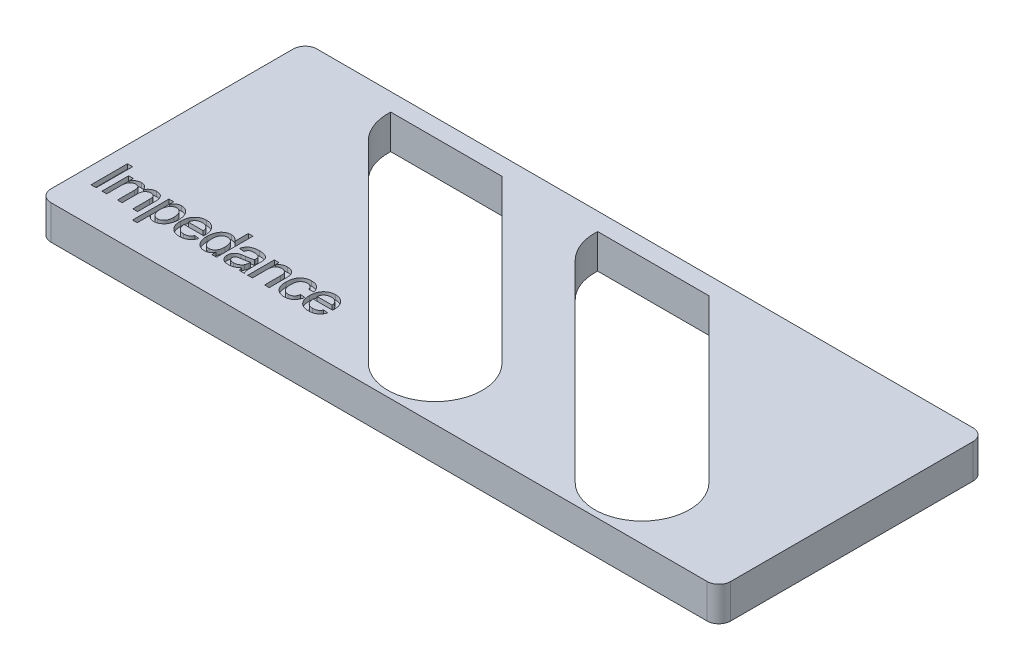
from build123d import *

# Parameters (mm, degrees)
BOSS_EXTRUDE1_DEPTH = 2.9
CUT_EXTRUDE3_DEPTH  = 10
SKETCH3_W           = 0.434638546
SKETCH3_H           = 3.081982422
CUT_EXTRUDE4_DEPTH  = 0.5


with BuildPart() as part:
    # Sketch1 → Boss-Extrude1 (new body)
    with BuildSketch(Plane(origin=(0, 0, 0), x_dir=(1, 0, 0), z_dir=(0, 1, 0))):
        with BuildLine():
            Line((1, 0), (56.5, 0))
            ThreePointArc((56.5, 0), (57.207106781, 0.292893219), (57.5, 1))
            Line((57.5, 1), (57.5, 21.5))
            ThreePointArc((57.5, 21.5), (57.207106781, 22.207106781), (56.5, 22.5))
            Line((56.5, 22.5), (1, 22.5))
            ThreePointArc((1, 22.5), (0.292893219, 22.207106781), (0, 21.5))
            Line((0, 21.5), (0, 1))
            ThreePointArc((0, 1), (0.292893219, 0.292893219), (1, 0))
        make_face()
    extrude(amount=BOSS_EXTRUDE1_DEPTH)

    # Sketch2 → Cut-Extrude3 (cut)
    with BuildSketch(Plane(origin=(0, 3, 0), x_dir=(1, 0, 0), z_dir=(0, 1, 0))):
        with BuildLine():
            Line((18.156854249, 21), (31.828427125, 7.328427125))
            ThreePointArc((31.828427125, 7.328427125), (31.828427125, 1.671572875), (26.171572875, 1.671572875))
            Line((26.171572875, 1.671572875), (9.908116908, 17.935028843))
            ThreePointArc((9.908116908, 17.935028843), (8.997362549, 19.342709039), (8.743544293, 21))
            Line((8.743544293, 21), (18.156854249, 21))
        make_face()
        with BuildLine():
            Line((35.656854249, 21), (49.328427125, 7.328427125))
            ThreePointArc((49.328427125, 7.328427125), (49.328427125, 1.671572875), (43.671572875, 1.671572875))
            Line((43.671572875, 1.671572875), (27.408116908, 17.935028843))
            ThreePointArc((27.408116908, 17.935028843), (26.497362549, 19.342709039), (26.243544293, 21))
            Line((26.243544293, 21), (35.656854249, 21))
        make_face()
    extrude(amount=-CUT_EXTRUDE3_DEPTH, mode=Mode.SUBTRACT)

    # Sketch3 → Cut-Extrude4 (cut)
    # profile 1 of 9: a face of its own
    with BuildSketch(Plane(origin=(0, 3, 0), x_dir=(1, 0, 0), z_dir=(0, 1, 0))):
        with Locations((1.612445225, 4.540991211)):
            Rectangle(SKETCH3_W, SKETCH3_H)
    # profile 2 of 9: a face of its own
    with BuildSketch(Plane(origin=(0, 3, 0), x_dir=(1, 0, 0), z_dir=(0, 1, 0))):
        with BuildLine():
            Line((2.324659752, 3), (2.324659752, 5.252217924))
            Line((2.324659752, 5.252217924), (2.719785704, 5.252217924))
            Line((2.719785704, 5.252217924), (2.719785704, 4.900926257))
            add(Edge.make_bspline(
                [(2.719785704, 4.900926257), (2.737179718, 4.929415421), (2.77149805, 4.985624446), (2.83514727, 5.060724793), (2.905728649, 5.127882251), (2.984106566, 5.186243828), (3.070150727, 5.233461139), (3.162634962, 5.267657893), (3.261182454, 5.287886444), (3.328637921, 5.290430692), (3.363100144, 5.291730519)],
                knots=[0, 0, 0, 0, 1.012837134, 1.998324314, 2.98019487, 3.968118755, 4.958650973, 5.951725623, 6.953560186, 8, 8, 8, 8], degree=3))
            add(Edge.make_bspline(
                [(3.363100144, 5.291730519), (3.400662819, 5.290596042), (3.472931705, 5.288413359), (3.575869892, 5.267088327), (3.668373143, 5.232350937), (3.750196849, 5.183894088), (3.820434427, 5.122309409), (3.880856139, 5.050568338), (3.928865005, 4.966708363), (3.950755853, 4.905233515), (3.961962914, 4.873761348)],
                knots=[0, 0, 0, 0, 1.14260047, 2.198311542, 3.184080093, 4.139503782, 5.07683556, 6.015590709, 6.984077836, 8, 8, 8, 8], degree=3))
            add(Edge.make_bspline(
                [(3.961962914, 4.873761348), (3.983822982, 4.907063215), (4.02620043, 4.971621485), (4.10080341, 5.056249037), (4.178334602, 5.129621037), (4.261974573, 5.18885319), (4.35055266, 5.235283716), (4.444320628, 5.26810289), (4.543141666, 5.287687991), (4.610539934, 5.290368404), (4.644789949, 5.291730519)],
                knots=[0, 0, 0, 0, 1.138522562, 2.207114883, 3.219638414, 4.186902816, 5.129823568, 6.072192529, 7.02033929, 8, 8, 8, 8], degree=3))
            add(Edge.make_bspline(
                [(4.644789949, 5.291730519), (4.671363286, 5.291126513), (4.723213947, 5.289947959), (4.798572282, 5.281130372), (4.869397918, 5.26733664), (4.935275973, 5.246668644), (4.996609175, 5.220858134), (5.053406012, 5.189321196), (5.104812669, 5.151313783), (5.151676055, 5.10781536), (5.193160462, 5.057920547), (5.229900955, 5.002251111), (5.260095788, 4.939830028), (5.284540506, 4.871422001), (5.304625978, 4.797187022), (5.317506204, 4.716267344), (5.326669292, 4.629487867), (5.327295109, 4.56941751), (5.327616984, 4.538521674)],
                knots=[0, 0, 0, 0, 1.095882962, 2.138318376, 3.1255456, 4.06796008, 4.980856081, 5.866385201, 6.740777206, 7.611659656, 8.497473544, 9.411000816, 10.356316449, 11.349910013, 12.40416823, 13.523408539, 14.726220937, 16, 16, 16, 16], degree=3))
            Line((5.327616984, 4.538521674), (5.327616984, 3))
            Line((5.327616984, 3), (4.932491033, 3))
            Line((4.932491033, 3), (4.932491033, 4.392818979))
            add(Edge.make_bspline(
                [(4.932491033, 4.392818979), (4.93192064, 4.427598661), (4.930863198, 4.492076156), (4.925802075, 4.581138367), (4.914000833, 4.65438789), (4.899128125, 4.714317471), (4.876943479, 4.763851844), (4.848520649, 4.80698279), (4.811658993, 4.844482358), (4.768746202, 4.876816475), (4.720454179, 4.903609467), (4.667390527, 4.922912678), (4.609863797, 4.934116672), (4.570136329, 4.93543792), (4.549712767, 4.936117162)],
                knots=[0, 0, 0, 0, 1.637099343, 3.034992218, 4.192454477, 5.125064895, 5.931363659, 6.734457378, 7.542615046, 8.392902438, 9.255454751, 10.131653416, 11.039498489, 12, 12, 12, 12], degree=3))
            add(Edge.make_bspline(
                [(4.549712767, 4.936117162), (4.531160543, 4.935682503), (4.494726542, 4.934828891), (4.44148282, 4.926935229), (4.390360579, 4.915714136), (4.342168354, 4.897975732), (4.295982057, 4.876270665), (4.252074708, 4.849891023), (4.211072786, 4.817740822), (4.172154906, 4.781621733), (4.136422333, 4.740054631), (4.106065017, 4.691950487), (4.081157148, 4.637970489), (4.059827196, 4.578529817), (4.043501707, 4.513382977), (4.0317807, 4.44236185), (4.025165203, 4.365574353), (4.024201194, 4.312365953), (4.023701344, 4.284776727)],
                knots=[0, 0, 0, 0, 0.936978583, 1.840096209, 2.715540616, 3.577474171, 4.428863993, 5.292176944, 6.159677271, 7.057388756, 7.97228745, 8.921538631, 9.921836886, 10.971267826, 12.108934396, 13.31095831, 14.605698001, 16, 16, 16, 16], degree=3))
            Line((4.023701344, 4.284776727), (4.023701344, 3))
            Line((4.023701344, 3), (3.628575393, 3))
            Line((3.628575393, 3), (3.628575393, 4.436653264))
            add(Edge.make_bspline(
                [(3.628575393, 4.436653264), (3.628426185, 4.456832357), (3.628138046, 4.495800621), (3.623437961, 4.552434835), (3.617149382, 4.605310884), (3.60709693, 4.654138002), (3.59499618, 4.699083085), (3.579385702, 4.739872688), (3.561651809, 4.777322825), (3.54051266, 4.810885096), (3.516507144, 4.840790158), (3.488817006, 4.866500535), (3.45779314, 4.888377789), (3.422675947, 4.905606183), (3.384302966, 4.919111809), (3.34250147, 4.928922655), (3.297237416, 4.935325968), (3.265782416, 4.935847315), (3.249501433, 4.936117162)],
                knots=[0, 0, 0, 0, 1.345752242, 2.598810075, 3.789149697, 4.895786345, 5.921724826, 6.890687139, 7.805619527, 8.681717145, 9.530827886, 10.356528998, 11.194466742, 12.054057324, 12.95727461, 13.903003647, 14.914602983, 16, 16, 16, 16], degree=3))
            add(Edge.make_bspline(
                [(3.249501433, 4.936117162), (3.224298946, 4.935305984), (3.174390332, 4.933699604), (3.101503722, 4.916619503), (3.031421652, 4.890543853), (2.965068822, 4.854302933), (2.904036515, 4.8082879), (2.85211713, 4.750897306), (2.809423144, 4.683974624), (2.781206694, 4.621321683), (2.763332003, 4.565707294), (2.751811361, 4.518846494), (2.742008745, 4.467727868), (2.734155094, 4.412070527), (2.727089108, 4.35220772), (2.723356244, 4.287687357), (2.719725563, 4.218962233), (2.719765204, 4.171595562), (2.719785704, 4.147100028)],
                knots=[0, 0, 0, 0, 1.117976261, 2.213934112, 3.307715435, 4.433034498, 5.561469973, 6.68771744, 7.851930709, 9.075635627, 9.729167061, 10.44550689, 11.218440431, 12.040901402, 12.942650761, 13.89578902, 14.911813504, 16, 16, 16, 16], degree=3))
            Line((2.719785704, 4.147100028), (2.719785704, 3))
            Line((2.719785704, 3), (2.324659752, 3))
        make_face()
    # profile 3 of 9: a face of its own
    with BuildSketch(Plane(origin=(0, 3, 0), x_dir=(1, 0, 0), z_dir=(0, 1, 0))):
        with BuildLine():
            Line((5.733608899, 2.170235502), (5.733608899, 5.252217924))
            Line((5.733608899, 5.252217924), (6.128734851, 5.252217924))
            Line((6.128734851, 5.252217924), (6.128734851, 4.894752414))
            add(Edge.make_bspline(
                [(6.128734851, 4.894752414), (6.148552427, 4.926202314), (6.186728156, 4.986786053), (6.251028053, 5.06854064), (6.320027109, 5.136950963), (6.393018088, 5.194078596), (6.472883218, 5.237865963), (6.559721246, 5.269801796), (6.654779099, 5.28844715), (6.720722877, 5.290612686), (6.75476253, 5.291730519)],
                knots=[0, 0, 0, 0, 1.141868254, 2.199646056, 3.187916027, 4.121412168, 5.038483649, 5.974824485, 6.95462054, 8, 8, 8, 8], degree=3))
            add(Edge.make_bspline(
                [(6.75476253, 5.291730519), (6.777417803, 5.291226045), (6.82221199, 5.290228596), (6.888418961, 5.283196924), (6.952872507, 5.272296409), (7.015271575, 5.256280516), (7.075282255, 5.235184158), (7.133111823, 5.209475875), (7.189389386, 5.180179287), (7.243112128, 5.145383655), (7.293989137, 5.106458153), (7.342753247, 5.064668605), (7.3870157, 5.017705745), (7.429198804, 4.968012655), (7.467555709, 4.914075096), (7.502143543, 4.856035762), (7.534239256, 4.794750235), (7.572031292, 4.707382296), (7.612166526, 4.592778814), (7.644785025, 4.448152679), (7.666055566, 4.297549653), (7.668489528, 4.194918408), (7.669726062, 4.142778338)],
                knots=[0, 0, 0, 0, 0.824202902, 1.629620634, 2.419929953, 3.200854495, 3.970497378, 4.731532444, 5.501903467, 6.276628953, 7.056871135, 7.831705169, 8.610184821, 9.402088757, 10.202023236, 11.014889876, 11.858855485, 12.71721399, 14.476656902, 16.267557585, 18.103795699, 20, 20, 20, 20], degree=3))
            add(Edge.make_bspline(
                [(7.669726062, 4.142778338), (7.668418706, 4.087131845), (7.665860138, 3.978228584), (7.642403256, 3.81907736), (7.604260626, 3.668401855), (7.559800404, 3.549533694), (7.517181696, 3.46012001), (7.48104846, 3.397658567), (7.442302835, 3.338938398), (7.400119251, 3.283953664), (7.353627711, 3.233598763), (7.304347259, 3.186521748), (7.251635289, 3.143571669), (7.177259015, 3.093348685), (7.080424156, 3.040750337), (6.959404145, 2.99413827), (6.834868645, 2.96600942), (6.750579423, 2.962327381), (6.708458708, 2.960487405)],
                knots=[0, 0, 0, 0, 1.566750505, 3.066217315, 4.520030908, 5.938083948, 6.632957415, 7.30813415, 7.968947793, 8.613647255, 9.257851326, 9.897527079, 10.532192309, 11.170526994, 12.423402314, 13.627070148, 14.814207778, 16, 16, 16, 16], degree=3))
            add(Edge.make_bspline(
                [(6.708458708, 2.960487405), (6.67790313, 2.961418962), (6.618127613, 2.963241355), (6.531021218, 2.981645446), (6.448335452, 3.009432599), (6.371837138, 3.050473245), (6.301101023, 3.099094709), (6.236745081, 3.154336762), (6.178403983, 3.215090484), (6.145336151, 3.26014363), (6.128734851, 3.282762009)],
                knots=[0, 0, 0, 0, 1.060500719, 2.074645059, 3.081194601, 4.082546779, 5.08044464, 6.05947861, 7.025785017, 8, 8, 8, 8], degree=3))
            Line((6.128734851, 3.282762009), (6.128734851, 2.170235502))
            Line((6.128734851, 2.170235502), (5.733608899, 2.170235502))
        make_face()
        with BuildLine():
            add(Edge.make_bspline(
                [(6.128734851, 4.107587433), (6.129115832, 4.074847165), (6.12985269, 4.011524015), (6.138119895, 3.919977903), (6.150851861, 3.835175456), (6.168533144, 3.756793747), (6.191944517, 3.68508702), (6.220271422, 3.619834216), (6.253752474, 3.561036074), (6.292616209, 3.509208105), (6.335687804, 3.464353475), (6.380009865, 3.424253302), (6.427153357, 3.390892212), (6.476302187, 3.36330981), (6.527926416, 3.342108186), (6.581903091, 3.327599217), (6.637722569, 3.317778204), (6.675695078, 3.316663723), (6.694876253, 3.316100761)],
                knots=[0, 0, 0, 0, 1.437434546, 2.78015081, 4.032764778, 5.2012756, 6.304456418, 7.34047555, 8.320212436, 9.269161424, 10.176980179, 11.047598006, 11.89018243, 12.707424221, 13.518042872, 14.333683991, 15.158288469, 16, 16, 16, 16], degree=3))
            add(Edge.make_bspline(
                [(6.694876253, 3.316100761), (6.714457865, 3.316701244), (6.753226565, 3.317890112), (6.810338954, 3.327151863), (6.864797363, 3.343612049), (6.917503266, 3.365117112), (6.967335539, 3.394117488), (7.016107885, 3.427895688), (7.061636995, 3.469360056), (7.105758349, 3.516035463), (7.146025186, 3.569791171), (7.180670143, 3.630828981), (7.209491421, 3.698704199), (7.233675978, 3.773026534), (7.251878637, 3.85451762), (7.265332806, 3.942579441), (7.273454045, 4.037670454), (7.274209007, 4.103249233), (7.27460011, 4.137221879)],
                knots=[0, 0, 0, 0, 0.83316913, 1.649551805, 2.453198062, 3.250183293, 4.066002037, 4.901882611, 5.770302609, 6.681184977, 7.632314019, 8.620852534, 9.660448002, 10.765528849, 11.942537832, 13.209677882, 14.554492318, 16, 16, 16, 16], degree=3))
            add(Edge.make_bspline(
                [(7.27460011, 4.137221879), (7.274211396, 4.169549991), (7.273457424, 4.232255377), (7.265243929, 4.322987011), (7.252335872, 4.407548474), (7.234879481, 4.485968916), (7.211400181, 4.558172257), (7.182289994, 4.623879555), (7.148357168, 4.68362521), (7.10927879, 4.736777226), (7.066853162, 4.783531754), (7.021863318, 4.824127288), (6.975303681, 4.858789174), (6.926291952, 4.88687104), (6.875610848, 4.909610946), (6.822322947, 4.924638989), (6.767267201, 4.934460305), (6.729904695, 4.935559089), (6.710928245, 4.936117162)],
                knots=[0, 0, 0, 0, 1.417753527, 2.749952742, 3.99222208, 5.168205227, 6.27013346, 7.316877701, 8.315654914, 9.278031164, 10.204687429, 11.080340169, 11.932552405, 12.745464952, 13.553904146, 14.362393741, 15.168258362, 16, 16, 16, 16], degree=3))
            add(Edge.make_bspline(
                [(6.710928245, 4.936117162), (6.691950453, 4.935583801), (6.654346883, 4.93452697), (6.59896284, 4.924228559), (6.545416383, 4.907565474), (6.493870515, 4.883578837), (6.443501774, 4.853758316), (6.394630656, 4.817372988), (6.348247113, 4.773358219), (6.303280517, 4.72385184), (6.26193391, 4.66782599), (6.225895407, 4.605524915), (6.195657582, 4.537178369), (6.171046066, 4.46271728), (6.152032234, 4.382334316), (6.138836854, 4.296023985), (6.129682158, 4.20388974), (6.129056961, 4.140332887), (6.128734851, 4.107587433)],
                knots=[0, 0, 0, 0, 0.806892931, 1.598819005, 2.388223016, 3.187667544, 4.012236564, 4.875742748, 5.774202643, 6.729148108, 7.718801443, 8.731210163, 9.785807378, 10.893572366, 12.063989118, 13.296455458, 14.607092894, 16, 16, 16, 16], degree=3))
        make_face(mode=Mode.SUBTRACT)
    # profile 4 of 9: a face of its own
    with BuildSketch(Plane(origin=(0, 3, 0), x_dir=(1, 0, 0), z_dir=(0, 1, 0))):
        with BuildLine():
            Line((9.498788787, 3.671714118), (9.885888742, 3.632201522))
            add(Edge.make_bspline(
                [(9.885888742, 3.632201522), (9.877951659, 3.606090642), (9.862337864, 3.554725432), (9.830657391, 3.481874031), (9.795844829, 3.412661744), (9.754714496, 3.348596783), (9.709584527, 3.288315652), (9.659560737, 3.232299177), (9.60354967, 3.181960741), (9.543633271, 3.135198161), (9.478814603, 3.094101733), (9.409776942, 3.057818486), (9.336267497, 3.027873974), (9.258496066, 3.002928521), (9.176284878, 2.98390274), (9.089786457, 2.970758862), (8.999114926, 2.961446926), (8.937199931, 2.960812437), (8.905482475, 2.960487405)],
                knots=[0, 0, 0, 0, 1.017198368, 2.001028156, 2.958938375, 3.904526299, 4.836491671, 5.766019286, 6.700699831, 7.641977538, 8.598163567, 9.559604839, 10.547559217, 11.555094156, 12.60347703, 13.691418688, 14.817373327, 16, 16, 16, 16], degree=3))
            add(Edge.make_bspline(
                [(8.905482475, 2.960487405), (8.865718172, 2.961421848), (8.788190112, 2.963243722), (8.674969823, 2.977859264), (8.568023938, 3.000979425), (8.467119551, 3.033736631), (8.372903298, 3.07642527), (8.285135924, 3.128927717), (8.203271507, 3.190030988), (8.12848848, 3.26081116), (8.060827785, 3.339696733), (8.003042787, 3.427410578), (7.952926845, 3.521850575), (7.913067799, 3.624550794), (7.881562964, 3.734482966), (7.859703595, 3.852114934), (7.845717974, 3.976979996), (7.844305961, 4.062890673), (7.84358148, 4.106970049)],
                knots=[0, 0, 0, 0, 1.077616366, 2.10101772, 3.089143248, 4.040031729, 4.971276009, 5.886882173, 6.807369977, 7.734796568, 8.672701003, 9.618074947, 10.576315496, 11.565652878, 12.598619221, 13.67195277, 14.805516698, 16, 16, 16, 16], degree=3))
            add(Edge.make_bspline(
                [(7.84358148, 4.106970049), (7.844312982, 4.152691371), (7.845733336, 4.241468241), (7.859539643, 4.370727195), (7.882372422, 4.492088753), (7.913355845, 4.605993223), (7.95441093, 4.711890359), (8.004505576, 4.809741555), (8.063330037, 4.900076606), (8.131452534, 4.981572715), (8.206830538, 5.054042637), (8.287069109, 5.118484376), (8.37385223, 5.171666004), (8.465405999, 5.215821057), (8.562612816, 5.249745405), (8.664873875, 5.274729018), (8.772967817, 5.288826586), (8.846791278, 5.290748855), (8.884491409, 5.291730519)],
                knots=[0, 0, 0, 0, 1.232307979, 2.392766439, 3.499416159, 4.558769794, 5.570548426, 6.555643267, 7.517416609, 8.470735273, 9.412423306, 10.33263532, 11.239503873, 12.150233765, 13.067967044, 14.009932887, 14.983713455, 16, 16, 16, 16], degree=3))
            add(Edge.make_bspline(
                [(8.884491409, 5.291730519), (8.920967718, 5.290792525), (8.992352919, 5.288956843), (9.096934651, 5.274223481), (9.196588395, 5.251200118), (9.291104931, 5.217759941), (9.380008563, 5.173864138), (9.464259456, 5.121473485), (9.543269061, 5.059071706), (9.616530655, 4.987509072), (9.683282872, 4.907589065), (9.741024541, 4.819001741), (9.789917371, 4.722992773), (9.829552326, 4.618828162), (9.860061859, 4.507108294), (9.882165205, 4.387760027), (9.89610462, 4.260823938), (9.897512623, 4.173479313), (9.898236428, 4.128578499)],
                knots=[0, 0, 0, 0, 1.005323219, 1.967446859, 2.906060863, 3.821317632, 4.724696067, 5.63467896, 6.55185077, 7.494776645, 8.453732942, 9.416859909, 10.403972786, 11.418730779, 12.484189468, 13.592581733, 14.76243057, 16, 16, 16, 16], degree=3))
            add(Edge.make_bspline(
                [(9.898236428, 4.128578499), (9.898048403, 4.114584139), (9.897594901, 4.080830885), (9.896831288, 4.047083142), (9.896384275, 4.027327474)],
                knots=[0, 0, 0, 0, 0.829215456, 2, 2, 2, 2], degree=3))
            Line((9.896384275, 4.027327474), (8.238707432, 4.027327474))
            add(Edge.make_bspline(
                [(8.238707432, 4.027327474), (8.240994909, 3.999500421), (8.24547013, 3.945059582), (8.258520527, 3.86623929), (8.276132353, 3.792164377), (8.299839948, 3.723487077), (8.327846511, 3.659438227), (8.362457909, 3.601071332), (8.401017949, 3.547090054), (8.445322475, 3.498810489), (8.493135652, 3.455866212), (8.544301487, 3.418194407), (8.598729242, 3.386948624), (8.655631531, 3.360680977), (8.715540095, 3.340914539), (8.778181532, 3.326769091), (8.843905447, 3.317919259), (8.888785068, 3.316714647), (8.911656318, 3.316100761)],
                knots=[0, 0, 0, 0, 1.224729154, 2.396059788, 3.502114335, 4.561587772, 5.580251543, 6.563724943, 7.533714888, 8.486186356, 9.43260269, 10.350144711, 11.268619442, 12.181885516, 13.095687177, 14.031096784, 14.996620783, 16, 16, 16, 16], degree=3))
            add(Edge.make_bspline(
                [(8.911656318, 3.316100761), (8.945049967, 3.317218835), (9.009741902, 3.319384827), (9.103086503, 3.334580815), (9.188651504, 3.361374392), (9.267038215, 3.398567386), (9.338116561, 3.447869717), (9.400138384, 3.510975791), (9.455280381, 3.585767814), (9.483960502, 3.642422393), (9.498788787, 3.671714118)],
                knots=[0, 0, 0, 0, 1.096312125, 2.123833578, 3.094060441, 4.030938787, 4.962563683, 5.918139224, 6.923629937, 8, 8, 8, 8], degree=3))
        make_face()
        with BuildLine():
            Line((8.238707432, 4.38294083), (9.503110477, 4.38294083))
            add(Edge.make_bspline(
                [(9.503110477, 4.38294083), (9.500623261, 4.402517966), (9.49576021, 4.440795549), (9.48552427, 4.496159291), (9.471872782, 4.547741261), (9.455431656, 4.595347717), (9.435382819, 4.639069797), (9.412730898, 4.678974588), (9.387420222, 4.715488247), (9.367748731, 4.736708469), (9.358025166, 4.747197567)],
                knots=[0, 0, 0, 0, 1.185316253, 2.317552585, 3.379013743, 4.387694847, 5.339152611, 6.263729899, 7.141766409, 8, 8, 8, 8], degree=3))
            add(Edge.make_bspline(
                [(9.358025166, 4.747197567), (9.342489127, 4.762361236), (9.311802793, 4.792312074), (9.260640369, 4.83092062), (9.205655873, 4.862938224), (9.14791827, 4.890563529), (9.086136126, 4.910577339), (9.021546406, 4.925696611), (8.953250008, 4.934261417), (8.906534292, 4.935489169), (8.882639256, 4.936117162)],
                knots=[0, 0, 0, 0, 0.989486767, 1.954405495, 2.91383024, 3.888017634, 4.867526279, 5.869356945, 6.910178459, 8, 8, 8, 8], degree=3))
            add(Edge.make_bspline(
                [(8.882639256, 4.936117162), (8.861012523, 4.935614944), (8.818679685, 4.934631885), (8.756314097, 4.927714111), (8.696540656, 4.916246217), (8.63946532, 4.899231156), (8.584879609, 4.878551366), (8.533167333, 4.852116211), (8.483966515, 4.82139948), (8.437473121, 4.786263716), (8.39541372, 4.746887619), (8.35694985, 4.704943316), (8.325105619, 4.658585242), (8.2968709, 4.609973379), (8.274762924, 4.557590616), (8.257358551, 4.502208618), (8.244969354, 4.443674754), (8.240813338, 4.403365857), (8.238707432, 4.38294083)],
                knots=[0, 0, 0, 0, 1.10270868, 2.158476208, 3.195774995, 4.201977093, 5.192014471, 6.168217026, 7.158254405, 8.146844603, 9.134487423, 10.093158795, 11.042305272, 11.996428104, 12.955501471, 13.934632866, 14.95345241, 16, 16, 16, 16], degree=3))
        make_face(mode=Mode.SUBTRACT)
    # profile 5 of 9: a face of its own
    with BuildSketch(Plane(origin=(0, 3, 0), x_dir=(1, 0, 0), z_dir=(0, 1, 0))):
        with BuildLine():
            Line((11.613083058, 3), (11.613083058, 3.340178749))
            add(Edge.make_bspline(
                [(11.613083058, 3.340178749), (11.595736093, 3.310037708), (11.561998616, 3.251417499), (11.500056459, 3.174168806), (11.433378594, 3.107523784), (11.359353759, 3.053971322), (11.279986286, 3.011420475), (11.194004289, 2.981444929), (11.10196366, 2.964185534), (11.038576628, 2.961737847), (11.006194292, 2.960487405)],
                knots=[0, 0, 0, 0, 1.103362039, 2.145888452, 3.135274512, 4.089918948, 5.037552437, 5.986650811, 6.971446531, 8, 8, 8, 8], degree=3))
            add(Edge.make_bspline(
                [(11.006194292, 2.960487405), (10.984771139, 2.9609896), (10.942230603, 2.961986822), (10.879136971, 2.969138136), (10.817000326, 2.979717552), (10.756674998, 2.99713047), (10.69708285, 3.016895017), (10.639468046, 3.042950914), (10.582510633, 3.072076146), (10.527937413, 3.107141934), (10.474559341, 3.144712439), (10.425497399, 3.188052758), (10.378137019, 3.23329021), (10.33497407, 3.28334387), (10.294057825, 3.336318559), (10.256394138, 3.393317701), (10.221805713, 3.453974461), (10.179502461, 3.540126703), (10.136465539, 3.655742137), (10.098413378, 3.803156814), (10.076157666, 3.960588945), (10.073468818, 4.06882742), (10.072091847, 4.124256809)],
                knots=[0, 0, 0, 0, 0.77053297, 1.530068252, 2.282316003, 3.034891571, 3.786446796, 4.538913108, 5.307166389, 6.0856609, 6.870571251, 7.652718378, 8.438047608, 9.225050126, 10.027638366, 10.844878463, 11.68052307, 12.538083257, 14.29538088, 16.10719674, 18.006478707, 20, 20, 20, 20], degree=3))
            add(Edge.make_bspline(
                [(10.072091847, 4.124256809), (10.073258967, 4.178663088), (10.075544897, 4.285223707), (10.097515185, 4.440985113), (10.130996713, 4.589403521), (10.170937102, 4.707144096), (10.210695133, 4.795684077), (10.243287709, 4.858065831), (10.279072512, 4.91647456), (10.31884976, 4.970482659), (10.362219029, 5.020407425), (10.408410685, 5.067137314), (10.458812157, 5.108945246), (10.511790122, 5.147513086), (10.567869347, 5.180975272), (10.625207042, 5.210900373), (10.684494227, 5.235813119), (10.74545003, 5.255950013), (10.807871502, 5.272286952), (10.871920511, 5.283190775), (10.937507833, 5.290230671), (10.981892233, 5.291226714), (11.004342139, 5.291730519)],
                knots=[0, 0, 0, 0, 1.942572473, 3.804739629, 5.607757427, 7.372400532, 8.234575402, 9.073137612, 9.885175988, 10.679209825, 11.466269922, 12.246051373, 13.023576858, 13.803011661, 14.584731492, 15.35415098, 16.111962335, 16.87916584, 17.645911282, 18.414627976, 19.198108944, 20, 20, 20, 20], degree=3))
            add(Edge.make_bspline(
                [(11.004342139, 5.291730519), (11.036740659, 5.290556928), (11.100198311, 5.288258263), (11.192689915, 5.26977551), (11.279900896, 5.239832716), (11.360194587, 5.196120531), (11.434815164, 5.144840697), (11.501637264, 5.084655965), (11.56281259, 5.018632429), (11.596225686, 4.968711552), (11.613083058, 4.943525774)],
                knots=[0, 0, 0, 0, 1.060352338, 2.076868624, 3.076621313, 4.068618914, 5.061440509, 6.03539041, 7.008827079, 8, 8, 8, 8], degree=3))
            Line((11.613083058, 4.943525774), (11.613083058, 6.081982422))
            Line((11.613083058, 6.081982422), (12.008209009, 6.081982422))
            Line((12.008209009, 6.081982422), (12.008209009, 3))
            Line((12.008209009, 3), (11.613083058, 3))
        make_face()
        with BuildLine():
            add(Edge.make_bspline(
                [(10.467217798, 4.124874193), (10.467612314, 4.092134667), (10.468377819, 4.028607894), (10.476542079, 3.936411288), (10.48974435, 3.850491481), (10.509080039, 3.771087001), (10.532741699, 3.697902911), (10.562534285, 3.631236158), (10.597858986, 3.571071219), (10.637881504, 3.517263667), (10.682197139, 3.470315042), (10.728126888, 3.429041695), (10.775994288, 3.393674492), (10.826547797, 3.366069465), (10.87851205, 3.343510409), (10.932729358, 3.327201945), (10.988995344, 3.317911975), (11.027152439, 3.316706464), (11.046324271, 3.316100761)],
                knots=[0, 0, 0, 0, 1.410877411, 2.737623334, 3.985990085, 5.15425658, 6.25668075, 7.296968516, 8.294984083, 9.258336811, 10.180925624, 11.073031181, 11.91760706, 12.739566167, 13.550247201, 14.355718555, 15.173839401, 16, 16, 16, 16], degree=3))
            add(Edge.make_bspline(
                [(11.046324271, 3.316100761), (11.065696079, 3.316741651), (11.103811924, 3.31800266), (11.160087657, 3.32659016), (11.213798683, 3.342305018), (11.265341744, 3.363377347), (11.314869414, 3.390138197), (11.3615598, 3.423725563), (11.406372513, 3.463051814), (11.44897166, 3.507960185), (11.48809199, 3.559128127), (11.52154893, 3.617353638), (11.549750527, 3.68182268), (11.573314547, 3.752446432), (11.590900783, 3.829416574), (11.603673744, 3.912356655), (11.611972988, 4.00164114), (11.612704517, 4.063322063), (11.613083058, 4.095239747)],
                knots=[0, 0, 0, 0, 0.85918428, 1.690525522, 2.516740253, 3.335408561, 4.156363302, 5.007314812, 5.880540866, 6.797374501, 7.748460685, 8.730022766, 9.767976038, 10.864778839, 12.027110887, 13.265104655, 14.584788925, 16, 16, 16, 16], degree=3))
            add(Edge.make_bspline(
                [(11.613083058, 4.095239747), (11.612699489, 4.130242875), (11.611956072, 4.198084377), (11.603708611, 4.295994436), (11.591104182, 4.386830391), (11.572666855, 4.470484799), (11.548892652, 4.547015453), (11.519610491, 4.616220029), (11.485984297, 4.678589425), (11.446056006, 4.733003933), (11.4025952, 4.780560441), (11.357038644, 4.822396321), (11.308213101, 4.857045968), (11.257669943, 4.886503995), (11.204295357, 4.908844577), (11.148430195, 4.92410938), (11.090347028, 4.934617653), (11.050487791, 4.935612569), (11.030272279, 4.936117162)],
                knots=[0, 0, 0, 0, 1.460870622, 2.831394293, 4.098585508, 5.286659173, 6.403387286, 7.438947734, 8.419411421, 9.354210979, 10.24820955, 11.105802691, 11.930715615, 12.742688104, 13.543632756, 14.337822166, 15.156989001, 16, 16, 16, 16], degree=3))
            add(Edge.make_bspline(
                [(11.030272279, 4.936117162), (11.010688892, 4.935524382), (10.971916677, 4.934350765), (10.915082792, 4.925018475), (10.860837345, 4.909114191), (10.808561641, 4.888621385), (10.759736259, 4.860112765), (10.712706998, 4.826542171), (10.66864651, 4.786335886), (10.62678162, 4.740423788), (10.589004417, 4.687761685), (10.556287079, 4.627994892), (10.528498502, 4.561345672), (10.505575666, 4.487590991), (10.489052171, 4.406629316), (10.475678377, 4.319110969), (10.46857844, 4.224390815), (10.467682205, 4.158840682), (10.467217798, 4.124874193)],
                knots=[0, 0, 0, 0, 0.845773811, 1.674507211, 2.479288598, 3.284953443, 4.093262871, 4.914908037, 5.777293998, 6.664794475, 7.594954488, 8.56988236, 9.601878838, 10.709817382, 11.900789722, 13.168188159, 14.532623814, 16, 16, 16, 16], degree=3))
        make_face(mode=Mode.SUBTRACT)
    # profile 6 of 9: a face of its own
    with BuildSketch(Plane(origin=(0, 3, 0), x_dir=(1, 0, 0), z_dir=(0, 1, 0))):
        with BuildLine():
            add(Edge.make_bspline(
                [(13.841593424, 3.276588166), (13.806964498, 3.249352572), (13.740247719, 3.196879934), (13.638327649, 3.128961831), (13.539825964, 3.073030793), (13.442776579, 3.030265121), (13.345374441, 2.999097582), (13.246007611, 2.976867065), (13.143122169, 2.96271699), (13.073202042, 2.961237412), (13.037759067, 2.960487405)],
                knots=[0, 0, 0, 0, 1.197047628, 2.306255791, 3.325459075, 4.272204958, 5.183179809, 6.100503351, 7.037132558, 8, 8, 8, 8], degree=3))
            add(Edge.make_bspline(
                [(13.037759067, 2.960487405), (13.008931605, 2.961159506), (12.953014652, 2.962463187), (12.871615113, 2.970250355), (12.795403744, 2.9844426), (12.724252217, 3.004364504), (12.657659435, 3.028554747), (12.5968097, 3.059904397), (12.540872156, 3.096208068), (12.490839844, 3.138441117), (12.446491343, 3.184864554), (12.407221773, 3.234238907), (12.374431826, 3.287222323), (12.346992508, 3.342933459), (12.325834919, 3.402162275), (12.311229067, 3.464509713), (12.302439438, 3.529877407), (12.301222479, 3.57434579), (12.300602214, 3.597010617)],
                knots=[0, 0, 0, 0, 1.258692688, 2.441500428, 3.565802525, 4.638326649, 5.664695568, 6.653201623, 7.620115754, 8.570354797, 9.504485475, 10.41940588, 11.319425392, 12.219534596, 13.126122865, 14.058869773, 15.010636805, 16, 16, 16, 16], degree=3))
            add(Edge.make_bspline(
                [(12.300602214, 3.597010617), (12.301338756, 3.623828692), (12.302787787, 3.676588987), (12.317046879, 3.753648632), (12.339016575, 3.827250142), (12.370846271, 3.896222919), (12.409465818, 3.960172198), (12.454362724, 4.018030421), (12.504234752, 4.069767475), (12.560687301, 4.11368727), (12.621258456, 4.151608986), (12.68531232, 4.185368403), (12.753130294, 4.213762471), (12.800349401, 4.228551078), (12.824144099, 4.236003367)],
                knots=[0, 0, 0, 0, 1.081160721, 2.127011708, 3.15154375, 4.173548368, 5.183333295, 6.160067524, 7.123185218, 8.075175306, 9.03822139, 10.004020623, 10.994184154, 12, 12, 12, 12], degree=3))
            add(Edge.make_bspline(
                [(12.824144099, 4.236003367), (12.844260928, 4.241173614), (12.888934932, 4.252655327), (12.963530522, 4.265892453), (13.051530104, 4.280513155), (13.114896546, 4.288511933), (13.148888241, 4.292802723)],
                knots=[0, 0, 0, 0, 0.755247122, 1.677198421, 2.753978269, 4, 4, 4, 4], degree=3))
            add(Edge.make_bspline(
                [(13.148888241, 4.292802723), (13.184496662, 4.297489365), (13.253288024, 4.306543416), (13.353010318, 4.320438851), (13.44540734, 4.335875622), (13.530541734, 4.352112486), (13.60855793, 4.367658861), (13.678897199, 4.385113626), (13.742208655, 4.402760755), (13.781552978, 4.416114676), (13.800228676, 4.422453425)],
                knots=[0, 0, 0, 0, 1.295688514, 2.50312072, 3.632112522, 4.674678079, 5.629835945, 6.501350263, 7.28863104, 8, 8, 8, 8], degree=3))
            add(Edge.make_bspline(
                [(13.800228676, 4.422453425), (13.800437546, 4.433360485), (13.800815891, 4.453117486), (13.801280028, 4.47946275), (13.802187197, 4.499209932), (13.802111008, 4.510121506), (13.802080829, 4.514443686)],
                knots=[0, 0, 0, 0, 1.422721786, 2.577112132, 3.436380362, 4, 4, 4, 4], degree=3))
            add(Edge.make_bspline(
                [(13.802080829, 4.514443686), (13.801633024, 4.531736094), (13.800773301, 4.5649351), (13.796815155, 4.612893452), (13.788683689, 4.656867678), (13.777726383, 4.697002523), (13.763820168, 4.733379936), (13.74539864, 4.76485003), (13.725270917, 4.793575645), (13.708532623, 4.809196995), (13.70021242, 4.816961993)],
                knots=[0, 0, 0, 0, 1.26154989, 2.42199954, 3.505345601, 4.517638791, 5.454101631, 6.334651141, 7.172195178, 8, 8, 8, 8], degree=3))
            add(Edge.make_bspline(
                [(13.70021242, 4.816961993), (13.688312156, 4.826573604), (13.663978897, 4.846227103), (13.62209129, 4.869575315), (13.577187069, 4.890992511), (13.527595485, 4.90759203), (13.47405643, 4.920341125), (13.416269105, 4.929539059), (13.354382582, 4.935139368), (13.311684189, 4.935784352), (13.289651861, 4.936117162)],
                knots=[0, 0, 0, 0, 0.839762797, 1.717118621, 2.62848608, 3.573318781, 4.586191294, 5.652292021, 6.78858503, 8, 8, 8, 8], degree=3))
            add(Edge.make_bspline(
                [(13.289651861, 4.936117162), (13.269065702, 4.935906944), (13.229503838, 4.935502953), (13.17202546, 4.931667304), (13.118822864, 4.925761326), (13.069532071, 4.917103162), (13.024794586, 4.906092681), (12.983767248, 4.893128379), (12.947020276, 4.877415984), (12.90333899, 4.852176961), (12.854185253, 4.811728626), (12.806061122, 4.747676796), (12.763820363, 4.670370352), (12.745125706, 4.61158632), (12.73524076, 4.580503806)],
                knots=[0, 0, 0, 0, 1.022193202, 1.964420342, 2.859404845, 3.679355848, 4.447752811, 5.145854219, 5.814144269, 6.427678132, 7.647232431, 8.943346363, 10.383770637, 12, 12, 12, 12], degree=3))
            Line((12.73524076, 4.580503806), (12.340114809, 4.620016401))
            add(Edge.make_bspline(
                [(12.340114809, 4.620016401), (12.349181039, 4.657092456), (12.366687377, 4.728684053), (12.405207244, 4.828533625), (12.451829155, 4.917208352), (12.5064506, 4.9963666), (12.573590091, 5.064643859), (12.652340805, 5.12474569), (12.744757894, 5.174852668), (12.848903927, 5.217366962), (12.963961877, 5.250884675), (13.088602004, 5.274707974), (13.221820589, 5.288936932), (13.313488295, 5.290781496), (13.360651055, 5.291730519)],
                knots=[0, 0, 0, 0, 1.021253436, 1.971977998, 2.856928585, 3.699335328, 4.537187707, 5.410097588, 6.342486875, 7.343316183, 8.417452201, 9.545747471, 10.737294414, 12, 12, 12, 12], degree=3))
            add(Edge.make_bspline(
                [(13.360651055, 5.291730519), (13.406777837, 5.290924286), (13.494684083, 5.289387805), (13.619644362, 5.277335954), (13.731218247, 5.256863105), (13.829149972, 5.227205998), (13.914279834, 5.191130488), (13.987779602, 5.151430672), (14.049305209, 5.106793783), (14.099453028, 5.056934207), (14.139683333, 5.00115365), (14.17220548, 4.939438486), (14.199369042, 4.871416259), (14.211373999, 4.822903682), (14.217580463, 4.797823079)],
                knots=[0, 0, 0, 0, 1.532418085, 2.920410157, 4.166262907, 5.295392887, 6.3126657, 7.233843889, 8.065362582, 8.82930282, 9.573337446, 10.341184706, 11.142406151, 12, 12, 12, 12], degree=3))
            add(Edge.make_bspline(
                [(14.217580463, 4.797823079), (14.220771741, 4.778720307), (14.228114033, 4.734769855), (14.232219114, 4.659149693), (14.236321975, 4.56573585), (14.236579192, 4.497372119), (14.236719376, 4.460113868)],
                knots=[0, 0, 0, 0, 0.685842966, 1.577944182, 2.67997895, 4, 4, 4, 4], degree=3))
            Line((14.236719376, 4.460113868), (14.236719376, 3.97793673))
            add(Edge.make_bspline(
                [(14.236719376, 3.97793673), (14.236946555, 3.937601052), (14.237380051, 3.860633893), (14.237666029, 3.750527024), (14.239363216, 3.651316556), (14.242802648, 3.562638826), (14.245643388, 3.484623721), (14.249077218, 3.417075869), (14.253976099, 3.36046421), (14.26122409, 3.299331789), (14.273861861, 3.230783676), (14.295272749, 3.152134424), (14.321291972, 3.074636112), (14.343911954, 3.024930294), (14.355257161, 3)],
                knots=[0, 0, 0, 0, 1.460752392, 2.787357723, 3.987454144, 5.053844556, 6.001073417, 6.814649835, 7.502887566, 8.058452826, 9.043678907, 10.023506295, 11.008675999, 12, 12, 12, 12], degree=3))
            Line((14.355257161, 3), (13.96013121, 3))
            add(Edge.make_bspline(
                [(13.96013121, 3), (13.945505658, 3.020194902), (13.916276574, 3.060554303), (13.883556144, 3.128476189), (13.85661572, 3.200207753), (13.846650619, 3.250875012), (13.841593424, 3.276588166)],
                knots=[0, 0, 0, 0, 0.98283144, 1.964183219, 2.966842269, 4, 4, 4, 4], degree=3))
        make_face()
        with BuildLine():
            add(Edge.make_bspline(
                [(13.802080829, 4.066840069), (13.784659876, 4.060642869), (13.747894972, 4.047564394), (13.68859632, 4.03181801), (13.623805909, 4.014524921), (13.55234497, 3.999664364), (13.475093309, 3.983926621), (13.391229175, 3.969964802), (13.301488414, 3.956406642), (13.239452254, 3.948201477), (13.207539749, 3.943980594)],
                knots=[0, 0, 0, 0, 0.729352295, 1.539213581, 2.419656264, 3.375381672, 4.41857158, 5.530700671, 6.729748458, 8, 8, 8, 8], degree=3))
            add(Edge.make_bspline(
                [(13.207539749, 3.943980594), (13.172714716, 3.939342029), (13.108437468, 3.930780539), (13.020702555, 3.914786262), (12.949287766, 3.89848462), (12.892223571, 3.881261562), (12.845858166, 3.860954861), (12.807451806, 3.835730779), (12.773414381, 3.807439987), (12.745762911, 3.774343143), (12.723177354, 3.738787037), (12.707959815, 3.700368333), (12.697234473, 3.660565913), (12.696233317, 3.633096599), (12.695728165, 3.619236452)],
                knots=[0, 0, 0, 0, 1.886220442, 3.481434204, 4.78676141, 5.817751327, 6.678319802, 7.493641666, 8.277504993, 9.045791761, 9.800124555, 10.528599956, 11.257578043, 12, 12, 12, 12], degree=3))
            add(Edge.make_bspline(
                [(12.695728165, 3.619236452), (12.696892147, 3.598248494), (12.699179834, 3.55699884), (12.721707615, 3.498700231), (12.756766039, 3.445971351), (12.805522102, 3.399338899), (12.868305345, 3.361663193), (12.943951249, 3.334599725), (13.031980262, 3.318997039), (13.094698201, 3.317103227), (13.127897175, 3.316100761)],
                knots=[0, 0, 0, 0, 0.849267971, 1.669148087, 2.501462232, 3.405991702, 4.385156294, 5.453560725, 6.652073551, 8, 8, 8, 8], degree=3))
            add(Edge.make_bspline(
                [(13.127897175, 3.316100761), (13.161945511, 3.316995674), (13.228687908, 3.318749904), (13.325660523, 3.337631879), (13.417282383, 3.36615848), (13.501490013, 3.407326011), (13.577576644, 3.45608283), (13.643443849, 3.511330674), (13.699539268, 3.571576815), (13.727656896, 3.617081836), (13.741577168, 3.639610134)],
                knots=[0, 0, 0, 0, 1.124426932, 2.204129629, 3.254288104, 4.289056288, 5.293189312, 6.235005055, 7.126199027, 8, 8, 8, 8], degree=3))
            add(Edge.make_bspline(
                [(13.741577168, 3.639610134), (13.750963938, 3.659099081), (13.771148819, 3.701007222), (13.787032075, 3.774397145), (13.79864964, 3.859011677), (13.799679095, 3.919639805), (13.800228676, 3.952006589)],
                knots=[0, 0, 0, 0, 0.806621552, 1.73452216, 2.790557523, 4, 4, 4, 4], degree=3))
            Line((13.800228676, 3.952006589), (13.802080829, 4.066840069))
        make_face(mode=Mode.SUBTRACT)
    # profile 7 of 9: a face of its own
    with BuildSketch(Plane(origin=(0, 3, 0), x_dir=(1, 0, 0), z_dir=(0, 1, 0))):
        with BuildLine():
            Line((14.647650366, 3), (14.647650366, 5.252217924))
            Line((14.647650366, 5.252217924), (15.042776317, 5.252217924))
            Line((15.042776317, 5.252217924), (15.042776317, 4.937969315))
            add(Edge.make_bspline(
                [(15.042776317, 4.937969315), (15.063148583, 4.966037389), (15.103114266, 5.02110047), (15.17265037, 5.093998142), (15.24948821, 5.154782703), (15.332008382, 5.205726117), (15.422119212, 5.243883391), (15.5184363, 5.271780444), (15.62149445, 5.288718647), (15.692405958, 5.290711042), (15.728690274, 5.291730519)],
                knots=[0, 0, 0, 0, 1.031609736, 2.02378021, 2.987167069, 3.941100767, 4.901503214, 5.890206968, 6.920451719, 8, 8, 8, 8], degree=3))
            add(Edge.make_bspline(
                [(15.728690274, 5.291730519), (15.760429274, 5.290954362), (15.8231777, 5.289419891), (15.915130858, 5.275634533), (16.003251357, 5.252524686), (16.086347691, 5.220938432), (16.16221624, 5.181509301), (16.230224158, 5.137687127), (16.286086544, 5.085578628), (16.332657553, 5.028510567), (16.37037001, 4.965755397), (16.401921462, 4.89807143), (16.42753457, 4.824856919), (16.438995427, 4.773473191), (16.444856061, 4.747197567)],
                knots=[0, 0, 0, 0, 1.157394283, 2.288183909, 3.382623741, 4.475775238, 5.523428825, 6.497939499, 7.417115662, 8.297706763, 9.177144922, 10.080641881, 11.018515479, 12, 12, 12, 12], degree=3))
            add(Edge.make_bspline(
                [(16.444856061, 4.747197567), (16.446636222, 4.737544268), (16.450445084, 4.716889918), (16.453639236, 4.682997726), (16.457537308, 4.644349718), (16.460722661, 4.600507684), (16.462044515, 4.551895025), (16.464444112, 4.498411812), (16.46451878, 4.439943323), (16.464986457, 4.399197652), (16.465229743, 4.378001756)],
                knots=[0, 0, 0, 0, 0.636116052, 1.361043949, 2.205423869, 3.155086239, 4.209902085, 5.358053507, 6.625659551, 8, 8, 8, 8], degree=3))
            Line((16.465229743, 4.378001756), (16.465229743, 3))
            Line((16.465229743, 3), (16.070103791, 3))
            Line((16.070103791, 3), (16.070103791, 4.344663004))
            add(Edge.make_bspline(
                [(16.070103791, 4.344663004), (16.06975497, 4.380489034), (16.069104395, 4.447307156), (16.061279792, 4.540397949), (16.048379435, 4.619316987), (16.02929586, 4.685471067), (16.003242926, 4.741820333), (15.968609403, 4.790396815), (15.926187528, 4.833747466), (15.875240365, 4.869703978), (15.818431559, 4.899437263), (15.756158837, 4.921366996), (15.68883105, 4.933568075), (15.642509813, 4.93525404), (15.618795868, 4.936117162)],
                knots=[0, 0, 0, 0, 1.506563537, 2.809849324, 3.925549524, 4.864928455, 5.69744782, 6.523597672, 7.362170172, 8.236610106, 9.134847232, 10.051947146, 11.002703294, 12, 12, 12, 12], degree=3))
            add(Edge.make_bspline(
                [(15.618795868, 4.936117162), (15.599438496, 4.935581976), (15.561426434, 4.93453103), (15.505265116, 4.928030947), (15.451649333, 4.914985122), (15.399310145, 4.899683267), (15.349872859, 4.877371547), (15.301923096, 4.851567817), (15.256163097, 4.82035695), (15.212078143, 4.784766364), (15.170764892, 4.742500701), (15.136532711, 4.690470283), (15.107626944, 4.630535152), (15.083304702, 4.562518566), (15.065402191, 4.485614653), (15.05190605, 4.400420578), (15.043908545, 4.306743259), (15.043164297, 4.241575759), (15.042776317, 4.207603689)],
                knots=[0, 0, 0, 0, 0.875846439, 1.719899191, 2.550914797, 3.36947983, 4.182361237, 4.99885925, 5.83023976, 6.683685912, 7.559383924, 8.491455913, 9.48648407, 10.564169653, 11.751799509, 13.052676251, 14.463548735, 16, 16, 16, 16], degree=3))
            Line((15.042776317, 4.207603689), (15.042776317, 3))
            Line((15.042776317, 3), (14.647650366, 3))
        make_face()
    # profile 8 of 9: a face of its own
    with BuildSketch(Plane(origin=(0, 3, 0), x_dir=(1, 0, 0), z_dir=(0, 1, 0))):
        with BuildLine():
            Line((18.298614158, 3.829764498), (18.693740109, 3.790251903))
            add(Edge.make_bspline(
                [(18.693740109, 3.790251903), (18.6882719, 3.758659875), (18.677531101, 3.696605988), (18.653143734, 3.606835193), (18.623152215, 3.522332895), (18.586933629, 3.443045541), (18.545278546, 3.369105443), (18.497249985, 3.300502914), (18.443265314, 3.237280814), (18.38380641, 3.179495288), (18.319179102, 3.128297554), (18.251401189, 3.082767197), (18.179355224, 3.045256406), (18.104214936, 3.014052602), (18.025419538, 2.990027515), (17.943028166, 2.972587813), (17.857004503, 2.962889581), (17.798555693, 2.961295998), (17.768898429, 2.960487405)],
                knots=[0, 0, 0, 0, 1.126290047, 2.212288299, 3.264625211, 4.274421374, 5.27199577, 6.243132084, 7.212758999, 8.189695438, 9.152066023, 10.106906036, 11.054818061, 12.001736236, 12.962610873, 13.945632539, 14.95760209, 16, 16, 16, 16], degree=3))
            add(Edge.make_bspline(
                [(17.768898429, 2.960487405), (17.731818661, 2.961520883), (17.659053682, 2.96354897), (17.552668617, 2.97694422), (17.451967021, 3.000552816), (17.356965323, 3.033358736), (17.267277181, 3.075386474), (17.183828453, 3.127796922), (17.10522293, 3.188584472), (17.033171594, 3.259011326), (16.968069054, 3.338117746), (16.911832625, 3.42599948), (16.86327906, 3.521342224), (16.824614513, 3.625239587), (16.794390701, 3.736857747), (16.773037001, 3.856670209), (16.759949764, 3.98443595), (16.758411813, 4.072364249), (16.757622947, 4.117465582)],
                knots=[0, 0, 0, 0, 1.023197875, 2.007913629, 2.952854009, 3.872368111, 4.776711232, 5.679644676, 6.586124885, 7.513792122, 8.45395957, 9.406953999, 10.38727148, 11.400874437, 12.46026104, 13.574150989, 14.755701814, 16, 16, 16, 16], degree=3))
            add(Edge.make_bspline(
                [(16.757622947, 4.117465582), (16.757969666, 4.147108969), (16.758654096, 4.20562554), (16.764341275, 4.291943291), (16.773465465, 4.375401453), (16.786553053, 4.455944595), (16.802851758, 4.533793609), (16.824195352, 4.608418368), (16.848176891, 4.680447382), (16.875790007, 4.749409176), (16.907244113, 4.815168796), (16.942822516, 4.876788629), (16.982820103, 4.933914338), (17.025894525, 4.987388396), (17.073654931, 5.036120019), (17.125039506, 5.080753502), (17.180178693, 5.121044039), (17.258433132, 5.1684704), (17.361892153, 5.217736565), (17.492495813, 5.260723364), (17.628752427, 5.286721537), (17.721453983, 5.290049459), (17.768281045, 5.291730519)],
                knots=[0, 0, 0, 0, 1.013805669, 2.001270362, 2.957354649, 3.884259307, 4.791280502, 5.67595866, 6.537369654, 7.386966453, 8.214944774, 9.028648359, 9.817495426, 10.598008034, 11.374511297, 12.14791384, 12.923651068, 13.707109795, 15.274991334, 16.830882343, 18.399158828, 20, 20, 20, 20], degree=3))
            add(Edge.make_bspline(
                [(17.768281045, 5.291730519), (17.797731402, 5.291113475), (17.855526053, 5.289902561), (17.939922492, 5.281146448), (18.02048961, 5.267053939), (18.09670123, 5.246781522), (18.169111499, 5.22076822), (18.237049392, 5.188581524), (18.300970215, 5.150832168), (18.360471482, 5.10737576), (18.415497306, 5.058801587), (18.464858123, 5.004632339), (18.509956141, 4.94626549), (18.549066152, 4.882472822), (18.584273831, 4.814217913), (18.612665752, 4.740526349), (18.637389631, 4.662510463), (18.648540064, 4.608203768), (18.654227514, 4.580503806)],
                knots=[0, 0, 0, 0, 1.132709169, 2.22287732, 3.260172152, 4.27594812, 5.252565374, 6.215743486, 7.163376455, 8.103906971, 9.045968701, 9.981589193, 10.918916077, 11.878868217, 12.855998669, 13.868839979, 14.912969196, 16, 16, 16, 16], degree=3))
            Line((18.654227514, 4.580503806), (18.259101562, 4.540991211))
            add(Edge.make_bspline(
                [(18.259101562, 4.540991211), (18.249939157, 4.572193623), (18.232415446, 4.631870315), (18.192269974, 4.713246993), (18.141944566, 4.782067907), (18.081933557, 4.838462145), (18.013624479, 4.881963523), (17.938861844, 4.913882707), (17.85688469, 4.932880879), (17.8000755, 4.935015349), (17.770750582, 4.936117162)],
                knots=[0, 0, 0, 0, 1.141726713, 2.183628378, 3.172002178, 4.124091198, 5.061356818, 6.004746239, 6.970049491, 8, 8, 8, 8], degree=3))
            add(Edge.make_bspline(
                [(17.770750582, 4.936117162), (17.748279449, 4.935578827), (17.704372677, 4.934526963), (17.640353885, 4.924698458), (17.57925168, 4.910400382), (17.521740905, 4.888283825), (17.466925563, 4.86115071), (17.415443376, 4.827700468), (17.367649556, 4.787657085), (17.323054719, 4.741994977), (17.282478348, 4.689641689), (17.247205251, 4.630239364), (17.218471443, 4.563401712), (17.194356672, 4.490054976), (17.175265706, 4.409528939), (17.162032577, 4.321773141), (17.153902988, 4.227103226), (17.153141979, 4.161728749), (17.152748898, 4.127961115)],
                knots=[0, 0, 0, 0, 0.934506579, 1.825950114, 2.690068634, 3.541100821, 4.383731181, 5.231784627, 6.089299408, 6.973555431, 7.883203127, 8.839396139, 9.840301414, 10.904673265, 12.049269491, 13.27993044, 14.595012659, 16, 16, 16, 16], degree=3))
            add(Edge.make_bspline(
                [(17.152748898, 4.127961115), (17.153113421, 4.09357304), (17.153815189, 4.027370145), (17.162224033, 3.931741826), (17.174629609, 3.843120913), (17.19332484, 3.761927072), (17.215658718, 3.687335477), (17.244859338, 3.620632843), (17.278701343, 3.560771108), (17.317961901, 3.508508625), (17.361457243, 3.463075827), (17.408703959, 3.424354096), (17.458305992, 3.390279151), (17.511730069, 3.36320428), (17.568253314, 3.341990773), (17.627976368, 3.32746535), (17.69058509, 3.31773487), (17.733463756, 3.316652413), (17.755315974, 3.316100761)],
                knots=[0, 0, 0, 0, 1.439417322, 2.771123253, 4.016540659, 5.182963063, 6.256782941, 7.271700823, 8.22505475, 9.129818122, 10.001307906, 10.851929949, 11.68361798, 12.516019905, 13.353091662, 14.205762507, 15.085604268, 16, 16, 16, 16], degree=3))
            add(Edge.make_bspline(
                [(17.755315974, 3.316100761), (17.772829563, 3.316386734), (17.807353194, 3.316950457), (17.858111236, 3.323505979), (17.906679115, 3.333119451), (17.953060993, 3.346764734), (17.996947711, 3.364887985), (18.038962575, 3.386417962), (18.078888686, 3.411773519), (18.11577282, 3.441735585), (18.150976898, 3.474845648), (18.181455975, 3.513609025), (18.209595611, 3.555803169), (18.234183498, 3.60241584), (18.255979303, 3.653110385), (18.273427139, 3.708245043), (18.288782461, 3.767294292), (18.295266748, 3.80849519), (18.298614158, 3.829764498)],
                knots=[0, 0, 0, 0, 1.014969467, 2.000756802, 2.962635172, 3.883905016, 4.799126561, 5.711777145, 6.618793064, 7.535724579, 8.464077664, 9.414562763, 10.387627853, 11.401965749, 12.465912699, 13.582944017, 14.752233276, 16, 16, 16, 16], degree=3))
        make_face()
    # profile 9 of 9: a face of its own
    with BuildSketch(Plane(origin=(0, 3, 0), x_dir=(1, 0, 0), z_dir=(0, 1, 0))):
        with BuildLine():
            Line((20.404265049, 3.671714118), (20.791365004, 3.632201522))
            add(Edge.make_bspline(
                [(20.791365004, 3.632201522), (20.783427921, 3.606090642), (20.767814126, 3.554725432), (20.736133653, 3.481874031), (20.701321091, 3.412661744), (20.660190758, 3.348596783), (20.615060789, 3.288315652), (20.565036999, 3.232299177), (20.509025932, 3.181960741), (20.449109533, 3.135198161), (20.384290865, 3.094101733), (20.315253204, 3.057818486), (20.241743759, 3.027873974), (20.163972328, 3.002928521), (20.08176114, 2.98390274), (19.995262719, 2.970758862), (19.904591188, 2.961446926), (19.842676193, 2.960812437), (19.810958737, 2.960487405)],
                knots=[0, 0, 0, 0, 1.017198368, 2.001028156, 2.958938375, 3.904526299, 4.836491671, 5.766019286, 6.700699831, 7.641977538, 8.598163567, 9.559604839, 10.547559217, 11.555094156, 12.60347703, 13.691418688, 14.817373327, 16, 16, 16, 16], degree=3))
            add(Edge.make_bspline(
                [(19.810958737, 2.960487405), (19.771194434, 2.961421848), (19.693666374, 2.963243722), (19.580446085, 2.977859264), (19.4735002, 3.000979425), (19.372595813, 3.033736631), (19.27837956, 3.07642527), (19.190612186, 3.128927717), (19.108747769, 3.190030988), (19.033964742, 3.26081116), (18.966304047, 3.339696733), (18.908519049, 3.427410578), (18.858403107, 3.521850575), (18.818544061, 3.624550794), (18.787039226, 3.734482966), (18.765179857, 3.852114934), (18.751194236, 3.976979996), (18.749782223, 4.062890673), (18.749057742, 4.106970049)],
                knots=[0, 0, 0, 0, 1.077616366, 2.10101772, 3.089143248, 4.040031729, 4.971276009, 5.886882173, 6.807369977, 7.734796568, 8.672701003, 9.618074947, 10.576315496, 11.565652878, 12.598619221, 13.67195277, 14.805516698, 16, 16, 16, 16], degree=3))
            add(Edge.make_bspline(
                [(18.749057742, 4.106970049), (18.749789244, 4.152691371), (18.751209598, 4.241468241), (18.765015905, 4.370727195), (18.787848684, 4.492088753), (18.818832107, 4.605993223), (18.859887192, 4.711890359), (18.909981838, 4.809741555), (18.968806299, 4.900076606), (19.036928796, 4.981572715), (19.1123068, 5.054042637), (19.192545371, 5.118484376), (19.279328492, 5.171666004), (19.370882261, 5.215821057), (19.468089078, 5.249745405), (19.570350137, 5.274729018), (19.678444079, 5.288826586), (19.75226754, 5.290748855), (19.789967671, 5.291730519)],
                knots=[0, 0, 0, 0, 1.232307979, 2.392766439, 3.499416159, 4.558769794, 5.570548426, 6.555643267, 7.517416609, 8.470735273, 9.412423306, 10.33263532, 11.239503873, 12.150233765, 13.067967044, 14.009932887, 14.983713455, 16, 16, 16, 16], degree=3))
            add(Edge.make_bspline(
                [(19.789967671, 5.291730519), (19.82644398, 5.290792525), (19.897829181, 5.288956843), (20.002410913, 5.274223481), (20.102064657, 5.251200118), (20.196581193, 5.217759941), (20.285484825, 5.173864138), (20.369735718, 5.121473485), (20.448745323, 5.059071706), (20.522006917, 4.987509072), (20.588759134, 4.907589065), (20.646500803, 4.819001741), (20.695393633, 4.722992773), (20.735028588, 4.618828162), (20.765538121, 4.507108294), (20.787641467, 4.387760027), (20.801580882, 4.260823938), (20.802988885, 4.173479313), (20.80371269, 4.128578499)],
                knots=[0, 0, 0, 0, 1.005323219, 1.967446859, 2.906060863, 3.821317632, 4.724696067, 5.63467896, 6.55185077, 7.494776645, 8.453732942, 9.416859909, 10.403972786, 11.418730779, 12.484189468, 13.592581733, 14.76243057, 16, 16, 16, 16], degree=3))
            add(Edge.make_bspline(
                [(20.80371269, 4.128578499), (20.803524665, 4.114584139), (20.803071163, 4.080830885), (20.80230755, 4.047083142), (20.801860537, 4.027327474)],
                knots=[0, 0, 0, 0, 0.829215456, 2, 2, 2, 2], degree=3))
            Line((20.801860537, 4.027327474), (19.144183694, 4.027327474))
            add(Edge.make_bspline(
                [(19.144183694, 4.027327474), (19.146471172, 3.999500421), (19.150946392, 3.945059582), (19.163996789, 3.86623929), (19.181608616, 3.792164377), (19.20531621, 3.723487077), (19.233322773, 3.659438227), (19.267934171, 3.601071332), (19.306494211, 3.547090054), (19.350798737, 3.498810489), (19.398611914, 3.455866212), (19.449777749, 3.418194407), (19.504205504, 3.386948624), (19.561107793, 3.360680977), (19.621016357, 3.340914539), (19.683657794, 3.326769091), (19.749381709, 3.317919259), (19.79426133, 3.316714647), (19.81713258, 3.316100761)],
                knots=[0, 0, 0, 0, 1.224729154, 2.396059788, 3.502114335, 4.561587772, 5.580251543, 6.563724943, 7.533714888, 8.486186356, 9.43260269, 10.350144711, 11.268619442, 12.181885516, 13.095687177, 14.031096784, 14.996620783, 16, 16, 16, 16], degree=3))
            add(Edge.make_bspline(
                [(19.81713258, 3.316100761), (19.850526229, 3.317218835), (19.915218164, 3.319384827), (20.008562765, 3.334580815), (20.094127766, 3.361374392), (20.172514477, 3.398567386), (20.243592823, 3.447869717), (20.305614646, 3.510975791), (20.360756643, 3.585767814), (20.389436764, 3.642422393), (20.404265049, 3.671714118)],
                knots=[0, 0, 0, 0, 1.096312125, 2.123833578, 3.094060441, 4.030938787, 4.962563683, 5.918139224, 6.923629937, 8, 8, 8, 8], degree=3))
        make_face()
        with BuildLine():
            Line((19.144183694, 4.38294083), (20.408586739, 4.38294083))
            add(Edge.make_bspline(
                [(20.408586739, 4.38294083), (20.406099523, 4.402517966), (20.401236472, 4.440795549), (20.391000532, 4.496159291), (20.377349044, 4.547741261), (20.360907918, 4.595347717), (20.340859081, 4.639069797), (20.31820716, 4.678974588), (20.292896484, 4.715488247), (20.273224993, 4.736708469), (20.263501428, 4.747197567)],
                knots=[0, 0, 0, 0, 1.185316253, 2.317552585, 3.379013743, 4.387694847, 5.339152611, 6.263729899, 7.141766409, 8, 8, 8, 8], degree=3))
            add(Edge.make_bspline(
                [(20.263501428, 4.747197567), (20.247965389, 4.762361236), (20.217279055, 4.792312074), (20.166116631, 4.83092062), (20.111132135, 4.862938224), (20.053394532, 4.890563529), (19.991612388, 4.910577339), (19.927022668, 4.925696611), (19.85872627, 4.934261417), (19.812010554, 4.935489169), (19.788115518, 4.936117162)],
                knots=[0, 0, 0, 0, 0.989486767, 1.954405495, 2.91383024, 3.888017634, 4.867526279, 5.869356945, 6.910178459, 8, 8, 8, 8], degree=3))
            add(Edge.make_bspline(
                [(19.788115518, 4.936117162), (19.766488785, 4.935614944), (19.724155947, 4.934631885), (19.661790359, 4.927714111), (19.602016918, 4.916246217), (19.544941582, 4.899231156), (19.490355871, 4.878551366), (19.438643595, 4.852116211), (19.389442777, 4.82139948), (19.342949383, 4.786263716), (19.300889982, 4.746887619), (19.262426112, 4.704943316), (19.230581881, 4.658585242), (19.202347162, 4.609973379), (19.180239186, 4.557590616), (19.162834813, 4.502208618), (19.150445616, 4.443674754), (19.1462896, 4.403365857), (19.144183694, 4.38294083)],
                knots=[0, 0, 0, 0, 1.10270868, 2.158476208, 3.195774995, 4.201977093, 5.192014471, 6.168217026, 7.158254405, 8.146844603, 9.134487423, 10.093158795, 11.042305272, 11.996428104, 12.955501471, 13.934632866, 14.95345241, 16, 16, 16, 16], degree=3))
        make_face(mode=Mode.SUBTRACT)
    extrude(amount=-CUT_EXTRUDE4_DEPTH, mode=Mode.SUBTRACT)


solid = part.part
